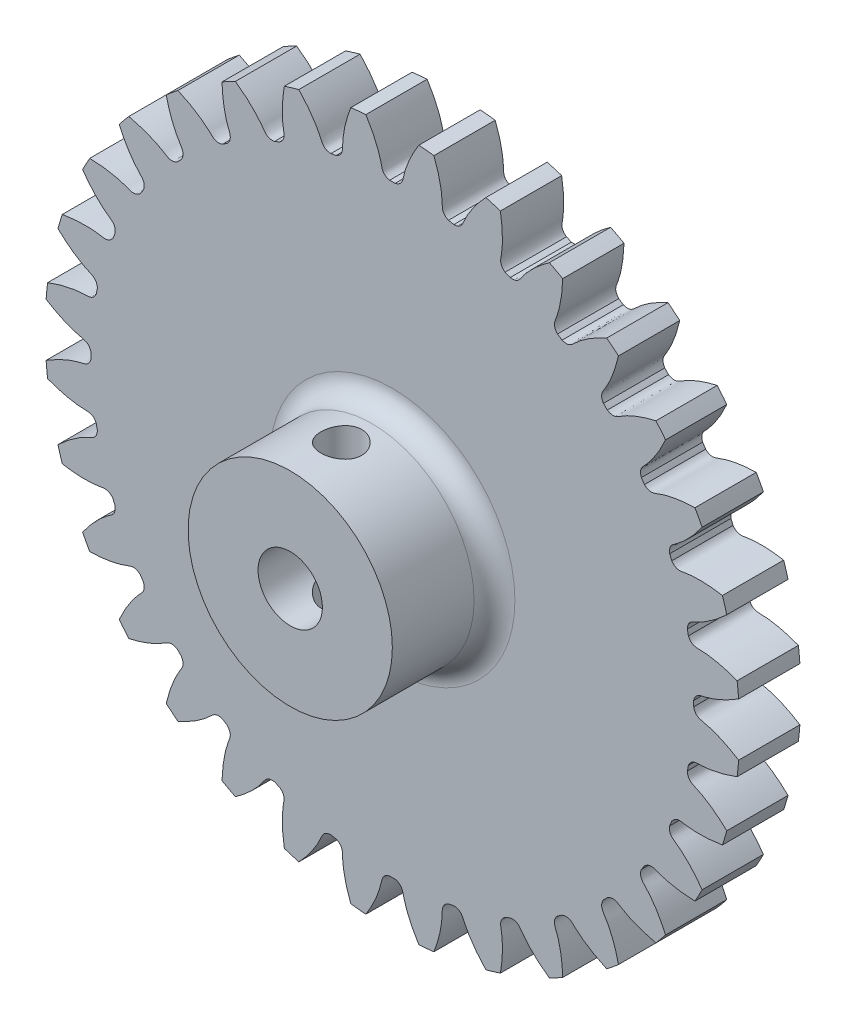
from build123d import *

# Parameters (mm, degrees)
SKETCH_1_R               = 17
EXTRUDE_1_DEPTH          = 3
CUT_EXTRUDE_1_DEPTH      = 25.228082879
PATTERN_CIRCULAR_1_COUNT = 32
SKETCH_5_R               = 5
EXTRUDE_2_DEPTH          = 5
CUT_EXTRUDE_3_DEPTH      = 26.271290668
CUT_EXTRUDE_3_DEPTH_BACK = 26.271290668
SKETCH_6_R               = 1
CUT_EXTRUDE_4_DEPTH      = 26.2712907
CUT_EXTRUDE_4_DEPTH_BACK = 26.2712907
SKETCH_7_R               = 1.575
FILLET_1_R               = 1


with BuildPart() as part:
    # 草图1 → 凸台-拉伸1 (new body)
    with BuildSketch(Plane.XY):
        Circle(SKETCH_1_R)
    extrude(amount=EXTRUDE_1_DEPTH)

    # 草图2 → 切除-拉伸1 (cut, through all)
    with BuildSketch(Plane.XY):
        with BuildLine():
            ThreePointArc((0.134032113, 14.749391018), (0, 14.75), (-0.134032113, 14.749391018))
            add(Edge.make_bspline(
                [(-0.134032113, 14.749391018), (-0.488819505, 14.835170409), (-0.508370843, 15.092413251), (-0.573428654, 15.360762052), (-0.590366116, 15.42536164), (-0.610257365, 15.495385754), (-0.63329346, 15.570753426), (-0.659705101, 15.651360434), (-0.689707388, 15.737100872), (-0.723516287, 15.827860723), (-0.761343463, 15.923519883), (-0.803397589, 16.023951666), (-0.849883738, 16.129023057), (-0.901003335, 16.238594755), (-0.956953955, 16.352521284), (-1.017929168, 16.470651081), (-1.08411837, 16.59282661), (-1.155706622, 16.718884458), (-1.232874495, 16.848655454), (-1.315797908, 16.981964783), (-1.404647982, 17.118632102), (-1.499590886, 17.258471665), (-1.600787686, 17.401292449), (-1.708394212, 17.546898287), (-1.822560903, 17.695087998), (-1.943432683, 17.845655527), (-2.071148817, 17.998390086), (-2.205842784, 18.1530763), (-2.347642151, 18.30949435), (-2.496668444, 18.46742013), (-2.653037047, 18.626625396), (-2.816857019, 18.786877929), (-3.048277665, 19.004375536), (-3.228997298, 19.164169992), (-3.353032537, 19.269606901)],
                knots=[0, 0, 0, 0, 0.124532679, 0.135328735, 0.147193327, 0.160126453, 0.174128116, 0.189198313, 0.205337046, 0.222544314, 0.240820117, 0.260164456, 0.28057733, 0.302058739, 0.324608684, 0.348227164, 0.372914179, 0.39866973, 0.425493816, 0.453386438, 0.482347595, 0.512377287, 0.543475514, 0.575642277, 0.608877575, 0.643181408, 0.678553777, 0.714994681, 0.752504121, 0.791082096, 0.830728606, 0.871443651, 0.913227232, 1, 1, 1, 1], degree=3))
            ThreePointArc((-3.353032537, 19.269606901), (0, 19.559155843), (3.353032537, 19.269606901))
            add(Edge.make_bspline(
                [(0.134032113, 14.749391018), (0.488819505, 14.835170409), (0.508370843, 15.092413251), (0.573428654, 15.360762052), (0.590366116, 15.42536164), (0.610257365, 15.495385754), (0.63329346, 15.570753426), (0.659705101, 15.651360434), (0.689707388, 15.737100872), (0.723516287, 15.827860723), (0.761343463, 15.923519883), (0.803397589, 16.023951666), (0.849883738, 16.129023057), (0.901003335, 16.238594755), (0.956953955, 16.352521284), (1.017929168, 16.470651081), (1.08411837, 16.59282661), (1.155706622, 16.718884458), (1.232874495, 16.848655454), (1.315797908, 16.981964783), (1.404647982, 17.118632102), (1.499590886, 17.258471665), (1.600787686, 17.401292449), (1.708394212, 17.546898287), (1.822560903, 17.695087998), (1.943432683, 17.845655527), (2.071148817, 17.998390086), (2.205842784, 18.1530763), (2.347642151, 18.30949435), (2.496668444, 18.46742013), (2.653037047, 18.626625396), (2.816857019, 18.786877929), (3.048277665, 19.004375536), (3.228997298, 19.164169992), (3.353032537, 19.269606901)],
                knots=[0, 0, 0, 0, 0.124532679, 0.135328735, 0.147193327, 0.160126453, 0.174128116, 0.189198313, 0.205337046, 0.222544314, 0.240820117, 0.260164456, 0.28057733, 0.302058739, 0.324608684, 0.348227164, 0.372914179, 0.39866973, 0.425493816, 0.453386438, 0.482347595, 0.512377287, 0.543475514, 0.575642277, 0.608877575, 0.643181408, 0.678553777, 0.714994681, 0.752504121, 0.791082096, 0.830728606, 0.871443651, 0.913227232, 1, 1, 1, 1], degree=3))
        make_face()
    cut_extrude_1 = extrude(amount=CUT_EXTRUDE_1_DEPTH, mode=Mode.SUBTRACT)

    # 阵列(圆周)1: 切除-拉伸1 ×32 about axis
    pattern_circular_1_axis = Axis((0, 0, -1.5), (0, 0, 1))
    for i in range(1, PATTERN_CIRCULAR_1_COUNT):
        add(cut_extrude_1.rotate(pattern_circular_1_axis, i * 360 / PATTERN_CIRCULAR_1_COUNT), mode=Mode.SUBTRACT)

    # 草图5 → 凸台-拉伸2 (add)
    with BuildSketch(Plane.XY.offset(3)):
        Circle(SKETCH_5_R)
    extrude(amount=EXTRUDE_2_DEPTH)

    # 草图6 → 切除-拉伸3 (cut, two sides: drawn at the far end of the back side and taken through both)
    with BuildSketch(Plane(origin=(0, 0, 0), x_dir=(1, 0, 0), z_dir=(0, 1, 0)).offset(-CUT_EXTRUDE_3_DEPTH_BACK)):
        with Locations((0, -5.5)):
            Circle(SKETCH_6_R)
    extrude(amount=CUT_EXTRUDE_3_DEPTH + CUT_EXTRUDE_3_DEPTH_BACK, mode=Mode.SUBTRACT)

    # 草图7 → 切除-拉伸4 (cut, two sides: drawn at the far end of the back side and taken through both)
    with BuildSketch(Plane.XY.offset(8).offset(-CUT_EXTRUDE_4_DEPTH_BACK)):
        Circle(SKETCH_7_R)
    extrude(amount=CUT_EXTRUDE_4_DEPTH + CUT_EXTRUDE_4_DEPTH_BACK, mode=Mode.SUBTRACT)

    # 圆角1
    fillet_1_edges = [part.edges().sort_by_distance(p)[0] for p in [
        (-5, 0, 3),
    ]]
    fillet(fillet_1_edges, radius=FILLET_1_R)


solid = part.part
